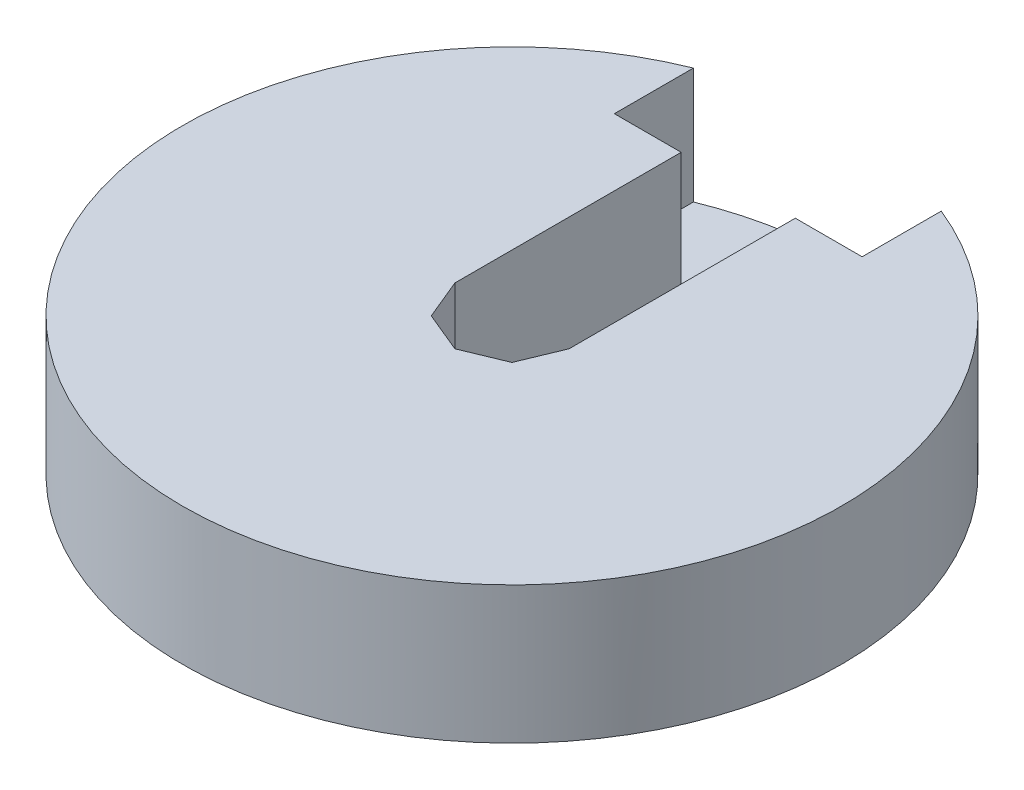
from build123d import *

# Parameters (mm, degrees)
SKETCH1_R           = 62.5
SKETCH1_R_2         = 4
SKETCH1_R_3         = 2.5
BOSS_EXTRUDE1_DEPTH = 5
BOSS_EXTRUDE3_DEPTH = 22
CUT_EXTRUDE1_DEPTH  = 20
CUT_EXTRUDE2_DEPTH  = 11
CUT_EXTRUDE3_START  = -5
SKETCH8_R           = 1
CUT_EXTRUDE3_DEPTH  = 5
SKETCH11_R          = 62.5
SKETCH11_R_2        = 12.5
CUT_EXTRUDE6_DEPTH  = 1


with BuildPart() as part:
    # Sketch1 → Boss-Extrude1 (new body)
    # profile 1 of 10: a face of its own
    with BuildSketch(Plane(origin=(0, 0, 0), x_dir=(1, 0, 0), z_dir=(0, 1, 0))):
        with Locations(Location((0, 0, 0), (0, 0, 270))):
            Circle(SKETCH1_R)
        Polygon((-10.823922003, 0), (-7.653668647, 7.653668647), (0, 10.823922003), (7.653668647, 7.653668647), (10.823922003, 0), (7.653668647, -7.653668647), (0, -10.823922003), (-7.653668647, -7.653668647), align=None, mode=Mode.SUBTRACT)
    # profile 2 of 10: a face of its own
    with BuildSketch(Plane(origin=(0, 0, 0), x_dir=(1, 0, 0), z_dir=(0, 1, 0))):
        Circle(SKETCH1_R_2)
        with Locations(Location((0, 0, 0), (0, 0, 270))):
            Circle(SKETCH1_R_3, mode=Mode.SUBTRACT)
    # profile 3 of 10: a face of its own
    with BuildSketch(Plane(origin=(0, 0, 0), x_dir=(1, 0, 0), z_dir=(0, 1, 0))):
        with BuildLine():
            Line((8.856111893, -4.750713856), (9.621478757, -2.902954791))
            Line((9.621478757, -2.902954791), (3.960853476, -0.558247028))
            ThreePointArc((3.960853476, -0.558247028), (3.69551813, -1.530733729), (3.195486611, -2.406006093))
            Line((3.195486611, -2.406006093), (8.856111893, -4.750713856))
        make_face()
    # profile 4 of 10: a face of its own
    with BuildSketch(Plane(origin=(0, 0, 0), x_dir=(1, 0, 0), z_dir=(0, 1, 0))):
        with BuildLine():
            Line((9.621478757, 2.902954791), (8.856111893, 4.750713856))
            Line((8.856111893, 4.750713856), (3.195486611, 2.406006093))
            ThreePointArc((3.195486611, 2.406006093), (3.69551813, 1.530733729), (3.960853476, 0.558247028))
            Line((3.960853476, 0.558247028), (9.621478757, 2.902954791))
        make_face()
    # profile 5 of 10: a face of its own
    with BuildSketch(Plane(origin=(0, 0, 0), x_dir=(1, 0, 0), z_dir=(0, 1, 0))):
        with BuildLine():
            Line((4.750713856, 8.856111893), (2.902954791, 9.621478757))
            Line((2.902954791, 9.621478757), (0.558247028, 3.960853476))
            ThreePointArc((0.558247028, 3.960853476), (1.530733729, 3.69551813), (2.406006093, 3.195486611))
            Line((2.406006093, 3.195486611), (4.750713856, 8.856111893))
        make_face()
    # profile 6 of 10: a face of its own
    with BuildSketch(Plane(origin=(0, 0, 0), x_dir=(1, 0, 0), z_dir=(0, 1, 0))):
        with BuildLine():
            Line((-0.558247028, 3.960853476), (-2.902954791, 9.621478757))
            Line((-2.902954791, 9.621478757), (-4.750713856, 8.856111893))
            Line((-4.750713856, 8.856111893), (-2.406006093, 3.195486611))
            ThreePointArc((-2.406006093, 3.195486611), (-1.530733729, 3.69551813), (-0.558247028, 3.960853476))
        make_face()
    # profile 7 of 10: a face of its own
    with BuildSketch(Plane(origin=(0, 0, 0), x_dir=(1, 0, 0), z_dir=(0, 1, 0))):
        with BuildLine():
            Line((-3.195486611, 2.406006093), (-8.856111893, 4.750713856))
            Line((-8.856111893, 4.750713856), (-9.621478757, 2.902954791))
            Line((-9.621478757, 2.902954791), (-3.960853476, 0.558247028))
            ThreePointArc((-3.960853476, 0.558247028), (-3.69551813, 1.530733729), (-3.195486611, 2.406006093))
        make_face()
    # profile 8 of 10: a face of its own
    with BuildSketch(Plane(origin=(0, 0, 0), x_dir=(1, 0, 0), z_dir=(0, 1, 0))):
        with BuildLine():
            ThreePointArc((-3.195486611, -2.406006093), (-3.69551813, -1.530733729), (-3.960853476, -0.558247028))
            Line((-3.960853476, -0.558247028), (-9.621478757, -2.902954791))
            Line((-9.621478757, -2.902954791), (-8.856111893, -4.750713856))
            Line((-8.856111893, -4.750713856), (-3.195486611, -2.406006093))
        make_face()
    # profile 9 of 10: a face of its own
    with BuildSketch(Plane(origin=(0, 0, 0), x_dir=(1, 0, 0), z_dir=(0, 1, 0))):
        with BuildLine():
            ThreePointArc((-0.558247028, -3.960853476), (-1.530733729, -3.69551813), (-2.406006093, -3.195486611))
            Line((-2.406006093, -3.195486611), (-4.750713856, -8.856111893))
            Line((-4.750713856, -8.856111893), (-2.902954791, -9.621478757))
            Line((-2.902954791, -9.621478757), (-0.558247028, -3.960853476))
        make_face()
    # profile 10 of 10: a face of its own
    with BuildSketch(Plane(origin=(0, 0, 0), x_dir=(1, 0, 0), z_dir=(0, 1, 0))):
        with BuildLine():
            Line((4.750713856, -8.856111893), (2.406006093, -3.195486611))
            ThreePointArc((2.406006093, -3.195486611), (1.530733729, -3.69551813), (0.558247028, -3.960853476))
            Line((0.558247028, -3.960853476), (2.902954791, -9.621478757))
            Line((2.902954791, -9.621478757), (4.750713856, -8.856111893))
        make_face()
    extrude(amount=BOSS_EXTRUDE1_DEPTH)

    # Sketch3 → Boss-Extrude3 (add)
    with BuildSketch(Plane(origin=(0, 5, 0), x_dir=(1, 0, 0), z_dir=(0, 1, 0))):
        with BuildLine():
            Line((-10.823922003, 0), (-10.823922003, 42.913728942))
            Line((-10.823922003, 42.913728942), (-23.5, 42.913728942))
            Line((-23.5, 42.913728942), (-23.5, 57.913728942))
            ThreePointArc((-23.5, 57.913728942), (0, -62.5), (23.5, 57.913728942))
            Line((23.5, 57.913728942), (23.5, 42.913728942))
            Line((23.5, 42.913728942), (10.823922003, 42.913728942))
            Line((10.823922003, 42.913728942), (10.823922003, 0))
            Line((10.823922003, 0), (7.653668647, -7.653668647))
            Line((7.653668647, -7.653668647), (0, -10.823922003))
            Line((0, -10.823922003), (-7.653668647, -7.653668647))
            Line((-7.653668647, -7.653668647), (-10.823922003, 0))
        make_face()
    extrude(amount=BOSS_EXTRUDE3_DEPTH)

    # Sketch4 → Cut-Extrude1 (cut)
    with BuildSketch(Plane(origin=(0, 0, -42.913728942), x_dir=(-1, 0, 0), z_dir=(0, 0, -1))):
        Polygon((-20.5, 25.25), (-21.366025404, 24.75), (-21.366025404, 23.75), (-20.5, 23.25), (-19.633974596, 23.75), (-19.633974596, 24.75), align=None)
        Polygon((-20.5, 8.75), (-21.366025404, 8.25), (-21.366025404, 7.25), (-20.5, 6.75), (-19.633974596, 7.25), (-19.633974596, 8.25), align=None)
        Polygon((20.5, 8.75), (19.633974596, 8.25), (19.633974596, 7.25), (20.5, 6.75), (21.366025404, 7.25), (21.366025404, 8.25), align=None)
        Polygon((20.5, 25.25), (19.633974596, 24.75), (19.633974596, 23.75), (20.5, 23.25), (21.366025404, 23.75), (21.366025404, 24.75), align=None)
    extrude(amount=-CUT_EXTRUDE1_DEPTH, mode=Mode.SUBTRACT)

    # Sketch7 → Cut-Extrude2 (cut)
    with BuildSketch(Plane(origin=(0, 0, -62.5), x_dir=(-1, 0, 0), z_dir=(0, 0, -1))):
        Polygon((-7.5, 4), (7.5, 4), (7.5, 2), (1.5, 2), (1.5, 0), (-1.5, 0), (-1.5, 2), (-7.5, 2), align=None)
    extrude(amount=-CUT_EXTRUDE2_DEPTH, mode=Mode.SUBTRACT)

    # Sketch8 → Cut-Extrude3 (cut)
    with BuildSketch(Plane.XZ.offset(CUT_EXTRUDE3_START)):
        with Locations(Location((-4, -57, 0), (0, 0, 270))):
            Circle(SKETCH8_R)
        with Locations(Location((4, -57, 0), (0, 0, 270))):
            Circle(SKETCH8_R)
    extrude(amount=CUT_EXTRUDE3_DEPTH, mode=Mode.SUBTRACT)

    # Sketch11 → Cut-Extrude6 (cut)
    with BuildSketch(Plane.XZ):
        with Locations(Location((0, 0, 0), (0, 0, 271.375230752))):
            Circle(SKETCH11_R)
        with Locations(Location((0, 0, 0), (0, 0, 270))):
            Circle(SKETCH11_R_2, mode=Mode.SUBTRACT)
    extrude(amount=-CUT_EXTRUDE6_DEPTH, mode=Mode.SUBTRACT)


solid = part.part
